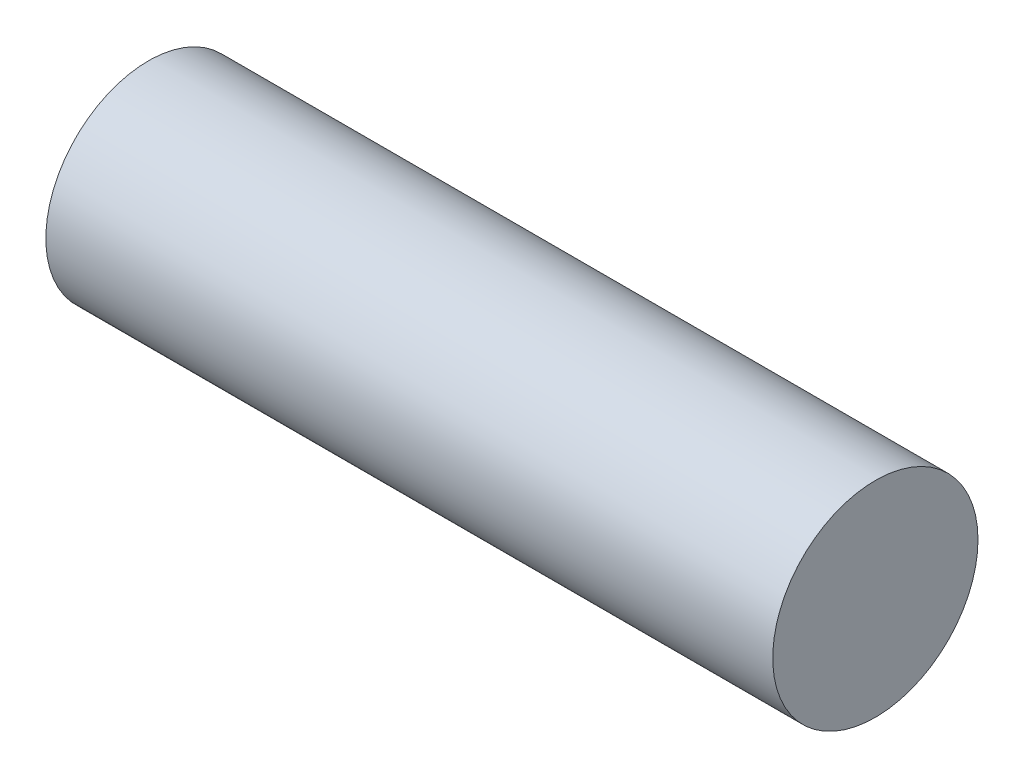
from build123d import *

# Parameters (mm, degrees)
SKETCH1_R           = 4.4831
BOSS_EXTRUDE1_DEPTH = 31.75


with BuildPart() as part:
    # Sketch1 → Boss-Extrude1 (new body)
    with BuildSketch(Plane(origin=(0, 0, 0), x_dir=(0, 0, -1), z_dir=(1, 0, 0))):
        Circle(SKETCH1_R)
    extrude(amount=BOSS_EXTRUDE1_DEPTH)


solid = part.part
